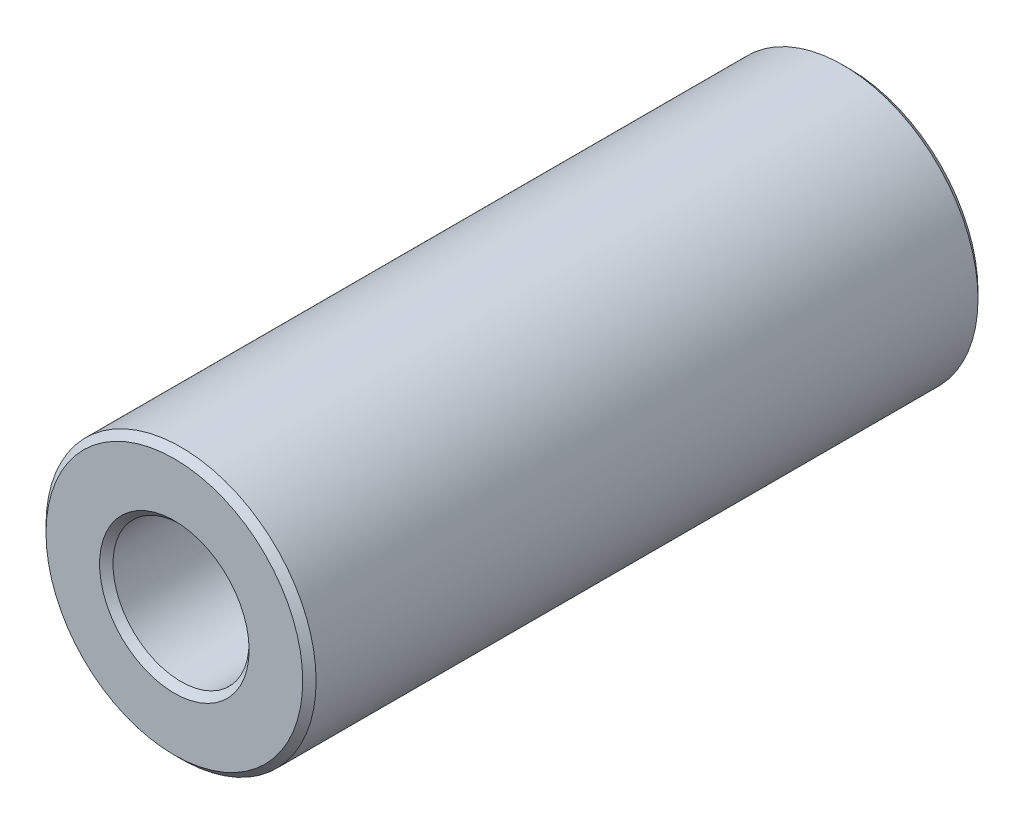
from build123d import *

# Parameters (mm, degrees)
BOSS_EXTRUDE1_DEPTH      = 15.875
BOSS_EXTRUDE1_DEPTH_BACK = 15.875
SKETCH3_R                = 6.35
SKETCH3_R_2              = 3.2004
CHAMFER1_SIZE            = 0.31496


with BuildPart() as part:
    # Sketch3 → Boss-Extrude1 (new, two sides: drawn at the far end of the back side and taken through both)
    with BuildSketch(Plane.XY.offset(-BOSS_EXTRUDE1_DEPTH_BACK)):
        Circle(SKETCH3_R)
        Circle(SKETCH3_R_2, mode=Mode.SUBTRACT)
    extrude(amount=BOSS_EXTRUDE1_DEPTH + BOSS_EXTRUDE1_DEPTH_BACK)

    # Chamfer1
    chamfer1_edges = [part.edges().sort_by_distance(p)[0] for p in [
        (-6.35, 0, -15.875),
        (-3.2004, 0, -15.875),
        (-6.35, 0, 15.875),
        (-3.2004, 0, 15.875),
    ]]
    chamfer(chamfer1_edges, length=CHAMFER1_SIZE)


solid = part.part
